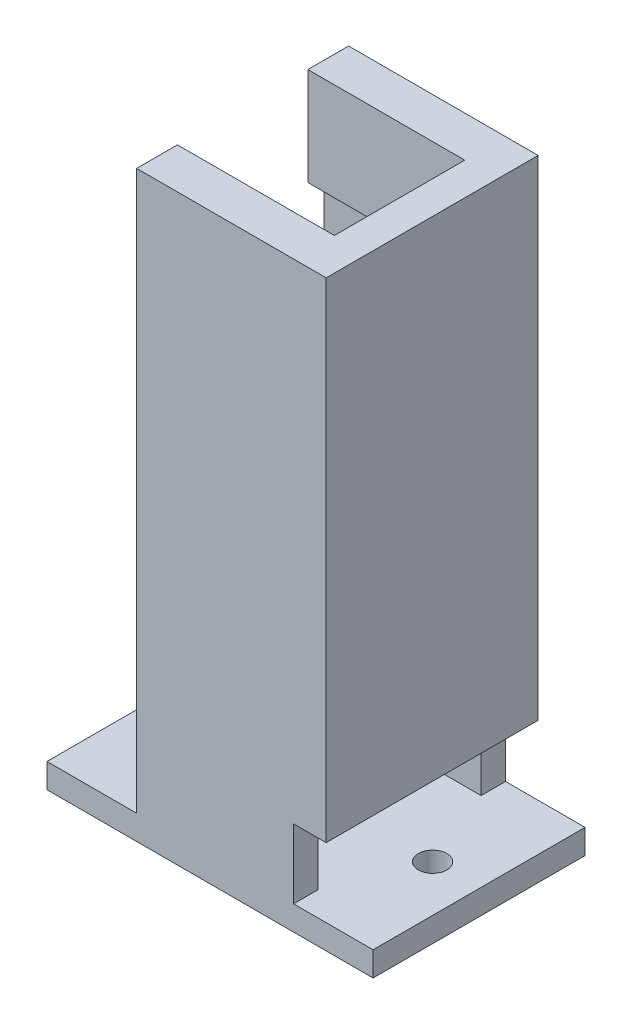
from build123d import *

# Parameters (mm, degrees)
SKETCH1_W           = 40
SKETCH1_H           = 26
BOSS_EXTRUDE1_DEPTH = 3
SKETCH2_R           = 1.75
CUT_EXTRUDE1_DEPTH  = 3
SKETCH3_W           = 19.25
SKETCH3_H           = 3
BOSS_EXTRUDE2_DEPTH = 56.5
SKETCH5_W           = 19.25
SKETCH5_H           = 5
BOSS_EXTRUDE4_DEPTH = 12
SKETCH6_R           = 2.5
CUT_EXTRUDE2_DEPTH  = 15
SKETCH7_W           = 26
SKETCH7_H           = 60
BOSS_EXTRUDE5_DEPTH = 4


with BuildPart() as part:
    # Sketch1 → Boss-Extrude1 (new body)
    with BuildSketch(Plane(origin=(0, 0, 0), x_dir=(1, 0, 0), z_dir=(0, 1, 0))):
        Rectangle(SKETCH1_W, SKETCH1_H)
    extrude(amount=BOSS_EXTRUDE1_DEPTH)

    # Sketch2 → Cut-Extrude1 (cut)
    with BuildSketch(Plane(origin=(0, 3, 0), x_dir=(1, 0, 0), z_dir=(0, 1, 0))):
        with Locations(Location((14.3, 0, 0), (0, 0, 270))):
            Circle(SKETCH2_R)
        with Locations(Location((-14.3, 0, 0), (0, 0, 90))):
            Circle(SKETCH2_R)
    extrude(amount=-CUT_EXTRUDE1_DEPTH, mode=Mode.SUBTRACT)

    # Sketch3 → Boss-Extrude2 (add)
    with BuildSketch(Plane(origin=(0, 3, 0), x_dir=(1, 0, 0), z_dir=(0, 1, 0))):
        with Locations((0.625, -11.5)):
            Rectangle(SKETCH3_W, SKETCH3_H)
        with Locations((0.625, 11.5)):
            Rectangle(SKETCH3_W, SKETCH3_H)
    extrude(amount=BOSS_EXTRUDE2_DEPTH)

    # Sketch5 → Boss-Extrude4 (add)
    with BuildSketch(Plane(origin=(0, 59.5, 0), x_dir=(1, 0, 0), z_dir=(0, 1, 0))):
        with Locations((0.625, 10.5)):
            Rectangle(SKETCH5_W, SKETCH5_H)
        with Locations((0.625, -10.5)):
            Rectangle(SKETCH5_W, SKETCH5_H)
    extrude(amount=BOSS_EXTRUDE4_DEPTH)

    # Sketch6 → Cut-Extrude2 (cut)
    with BuildSketch(Plane(origin=(0, 3, 0), x_dir=(1, 0, 0), z_dir=(0, 1, 0))):
        with Locations(Location((0, 0, 0), (0, 0, 270))):
            Circle(SKETCH6_R)
    extrude(amount=-CUT_EXTRUDE2_DEPTH, mode=Mode.SUBTRACT)

    # Sketch7 → Boss-Extrude5 (add)
    with BuildSketch(Plane(origin=(10.25, 0, 0), x_dir=(0, 0, -1), z_dir=(1, 0, 0))):
        with Locations((0, 41.5)):
            Rectangle(SKETCH7_W, SKETCH7_H)
    extrude(amount=BOSS_EXTRUDE5_DEPTH)


solid = part.part
